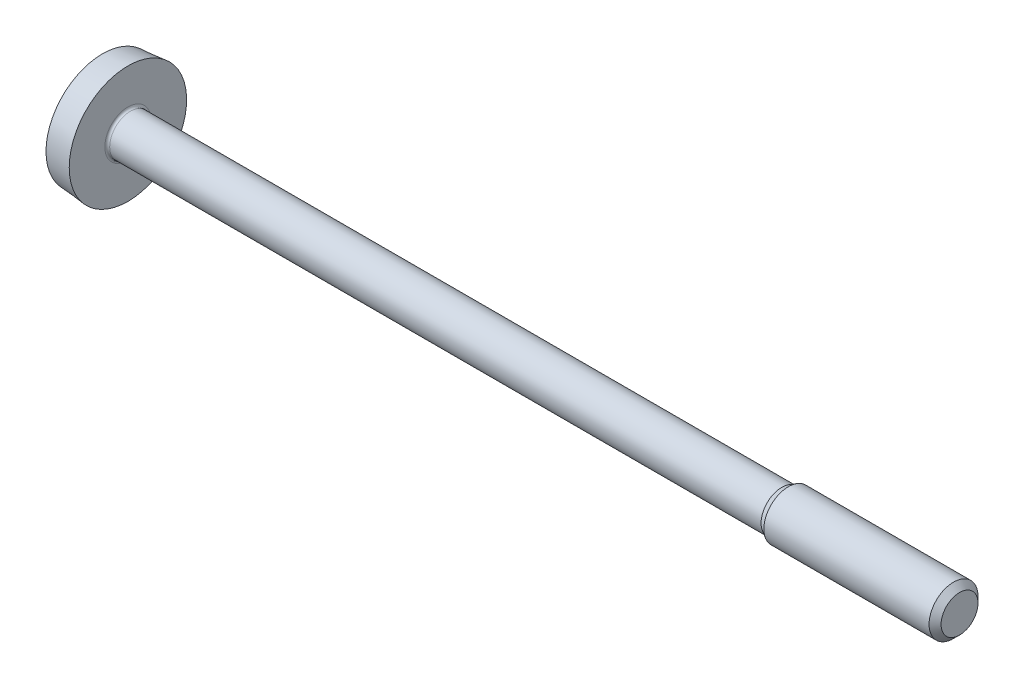
from build123d import *

# Parameters (mm, degrees)
SCHNITT_LINEAR_AUSTRAGEN1_DEPTH = 0.6


with BuildPart() as part:
    # Skizze1 → Rotation1 (revolve)
    with BuildSketch(Plane.XY):
        with BuildLine():
            Line((-1.04, 2.30901179), (0, 2.4))
            Line((0, 2.4), (0, 0.945))
            ThreePointArc((0, 0.945), (0.029289322, 0.874289322), (0.1, 0.845))
            Line((0.1, 0.845), (26.731532125, 0.845))
            Line((26.731532125, 0.845), (27, 1))
            Line((27, 1), (33.7545, 1))
            Line((33.7545, 1), (34, 0.7545))
            Line((34, 0.7545), (34, 0))
            Line((34, 0), (-1.6, 0))
            ThreePointArc((-1.6, 0), (-1.457999714, 1.187974689), (-1.04, 2.30901179))
        make_face()
    revolve(axis=Axis((34, 0, 0), (-1, 0, 0)))

    # Skizze2 → Schnitt-Linear austragen1 (cut)
    with BuildSketch(Plane(origin=(-1.04, 0, 0), x_dir=(0, 0, -1), z_dir=(1, 0, 0))):
        Polygon((-1, 0.29), (-1, -0.29), (-0.29, -0.29), (-0.29, -2.5), (0.29, -2.5), (0.29, -0.29), (1, -0.29), (1, 0.29), (0.29, 0.29), (0.29, 2.5), (-0.29, 2.5), (-0.29, 0.29), align=None)
    extrude(amount=-SCHNITT_LINEAR_AUSTRAGEN1_DEPTH, mode=Mode.SUBTRACT)


solid = part.part
